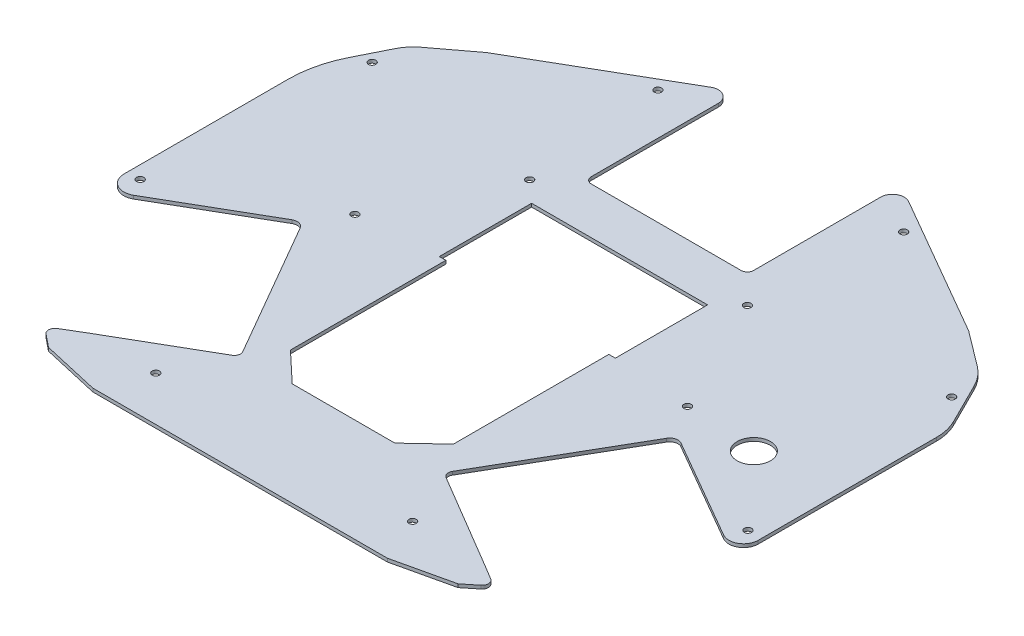
from build123d import *

# Parameters (mm, degrees)
SKETCH1_R           = 1.75
BOSS_EXTRUDE1_DEPTH = 1.6
SKETCH3_R           = 8
CUT_EXTRUDE1_DEPTH  = 1.6


with BuildPart() as part:
    # Sketch1 → Boss-Extrude1 (new body)
    with BuildSketch(Plane(origin=(0, 0, 0), x_dir=(1, 0, 0), z_dir=(0, 1, 0))):
        with BuildLine():
            Line((24.696313384, 21.403189927), (-19.414899465, 47.563680085))
            ThreePointArc((-19.414899465, 47.563680085), (-20.786874634, 49.384536896), (-20.482680557, 51.644028288))
            Line((-20.482680557, 51.644028288), (17.162414168, 116.847245007))
            ThreePointArc((17.162414168, 116.847245007), (19.546471274, 118.676596366), (22.525800971, 118.28436017))
            Line((22.525800971, 118.28436017), (70.987796177, 90.304814192))
            ThreePointArc((70.987796177, 90.304814192), (77.999004119, 90.304814192), (81.50460809, 96.376698381))
            Line((81.50460809, 96.376698381), (81.50460809, 182.02519482))
            ThreePointArc((81.50460809, 182.02519482), (80.873629228, 187.452491566), (79.01435205, 192.590270527))
            Line((79.01435205, 192.590270527), (69.144094326, 212.364639151))
            ThreePointArc((69.144094326, 212.364639151), (65.989183491, 217.196365343), (61.81193417, 221.177524531))
            Line((61.81193417, 221.177524531), (44.99314954, 233.854205885))
            Line((44.99314954, 233.854205885), (-23.199197227, 273.225075648))
            ThreePointArc((-23.199197227, 273.225075648), (-28.860512938, 273.225075648), (-31.691170793, 268.322232423))
            Line((-31.691170793, 268.322232423), (-31.691170793, 207.371759387))
            ThreePointArc((-31.691170793, 207.371759387), (-32.56985045, 205.250439044), (-34.691170793, 204.371759387))
            Line((-34.691170793, 204.371759387), (-106.595635326, 204.371759387))
            ThreePointArc((-106.595635326, 204.371759387), (-108.71695567, 205.250439044), (-109.595635326, 207.371759387))
            Line((-109.595635326, 207.371759387), (-109.595635326, 268.322232423))
            ThreePointArc((-109.595635326, 268.322232423), (-112.426293182, 273.225075648), (-118.087608892, 273.225075648))
            Line((-118.087608892, 273.225075648), (-186.279955659, 233.854205885))
            Line((-186.279955659, 233.854205885), (-204.21495553, 220.336208987))
            ThreePointArc((-204.21495553, 220.336208987), (-207.400637767, 217.300070339), (-209.806657286, 213.615266508))
            Line((-209.806657286, 213.615266508), (-217.247579174, 198.707901735))
            ThreePointArc((-217.247579174, 198.707901735), (-221.386722215, 187.270122423), (-222.791414209, 175.187815477))
            Line((-222.791414209, 175.187815477), (-222.791414209, 96.376698381))
            ThreePointArc((-222.791414209, 96.376698381), (-219.069332913, 89.929864467), (-211.625170321, 89.929864467))
            Line((-211.625170321, 89.929864467), (-163.512384372, 117.707794386))
            ThreePointArc((-163.512384372, 117.707794386), (-160.504762554, 118.10375531), (-158.098066116, 116.257032182))
            Line((-158.098066116, 116.257032182), (-120.496410943, 51.129054973))
            ThreePointArc((-120.496410943, 51.129054973), (-120.196709676, 48.852597838), (-121.594487155, 47.030978762))
            Line((-121.594487155, 47.030978762), (-165.983119503, 21.403189927))
            Line((-165.983119503, 21.403189927), (-174.676412504, 16.182853027))
            ThreePointArc((-174.676412504, 16.182853027), (-176.124776412, 13.818668342), (-175.016914475, 11.277060748))
            Line((-175.016914475, 11.277060748), (-168.860075369, 6.304549502))
            Line((-168.860075369, 6.304549502), (-141.286806119, 0))
            Line((-141.286806119, 0), (0, 0))
            Line((0, 0), (27.57326925, 6.304549502))
            Line((27.57326925, 6.304549502), (33.730108356, 11.277060748))
            ThreePointArc((33.730108356, 11.277060748), (34.837970293, 13.818668342), (33.389606385, 16.182853027))
            Line((33.389606385, 16.182853027), (24.696313384, 21.403189927))
        make_face()
        with Locations(Location((-123.091146174, 191.349343748, 0), (0, 0, 270))):
            Circle(SKETCH1_R, mode=Mode.SUBTRACT)
        with Locations(Location((-216.641081117, 98.036380822, 0), (0, 0, 270))):
            Circle(SKETCH1_R, mode=Mode.SUBTRACT)
        with Locations(Location((-18.645659945, 191.349343748, 0), (0, 0, 90))):
            Circle(SKETCH1_R, mode=Mode.SUBTRACT)
        with Locations(Location((74.914274997, 98.036380822, 0), (0, 0, 90))):
            Circle(SKETCH1_R, mode=Mode.SUBTRACT)
        with Locations(Location((-9.245725003, 21.35, 0), (0, 0, 270))):
            Circle(SKETCH1_R, mode=Mode.SUBTRACT)
        with Locations(Location((-132.441081117, 21.35, 0), (0, 0, 270))):
            Circle(SKETCH1_R, mode=Mode.SUBTRACT)
        with Locations(Location((-150.641414209, 135.049343748, 0), (0, 0, 270))):
            Circle(SKETCH1_R, mode=Mode.SUBTRACT)
        with Locations(Location((8.91460809, 135.049343748, 0), (0, 0, 270))):
            Circle(SKETCH1_R, mode=Mode.SUBTRACT)
        with Locations(Location((68.354340055, 202.349343748, 0), (0, 0, 270))):
            Circle(SKETCH1_R, mode=Mode.SUBTRACT)
        with Locations(Location((-11.691170793, 259.371759387, 0), (0, 0, 270))):
            Circle(SKETCH1_R, mode=Mode.SUBTRACT)
        with Locations(Location((-129.595635326, 259.371759387, 0), (0, 0, 270))):
            Circle(SKETCH1_R, mode=Mode.SUBTRACT)
        with Locations(Location((-209.641146174, 202.349343748, 0), (0, 0, 270))):
            Circle(SKETCH1_R, mode=Mode.SUBTRACT)
        Polygon((-31.555725003, 63.222149708), (-46.022445575, 49.606380822), (-95.264360544, 49.606380822), (-109.731081117, 63.222149708), (-109.731081117, 137.774232151), (-112.861146174, 137.774232151), (-112.861146174, 182.049343748), (-28.425659945, 182.049343748), (-28.425659945, 137.774232151), (-31.555725003, 137.774232151), align=None, mode=Mode.SUBTRACT)
    extrude(amount=BOSS_EXTRUDE1_DEPTH)

    # Sketch3 → Cut-Extrude1 (cut)
    with BuildSketch(Plane(origin=(0, 1.6, 0), x_dir=(1, 0, 0), z_dir=(0, 1, 0))):
        with Locations(Location((43.415663258, 132.362201431, 0), (0, 0, 270))):
            Circle(SKETCH3_R)
    extrude(amount=-CUT_EXTRUDE1_DEPTH, mode=Mode.SUBTRACT)


solid = part.part
